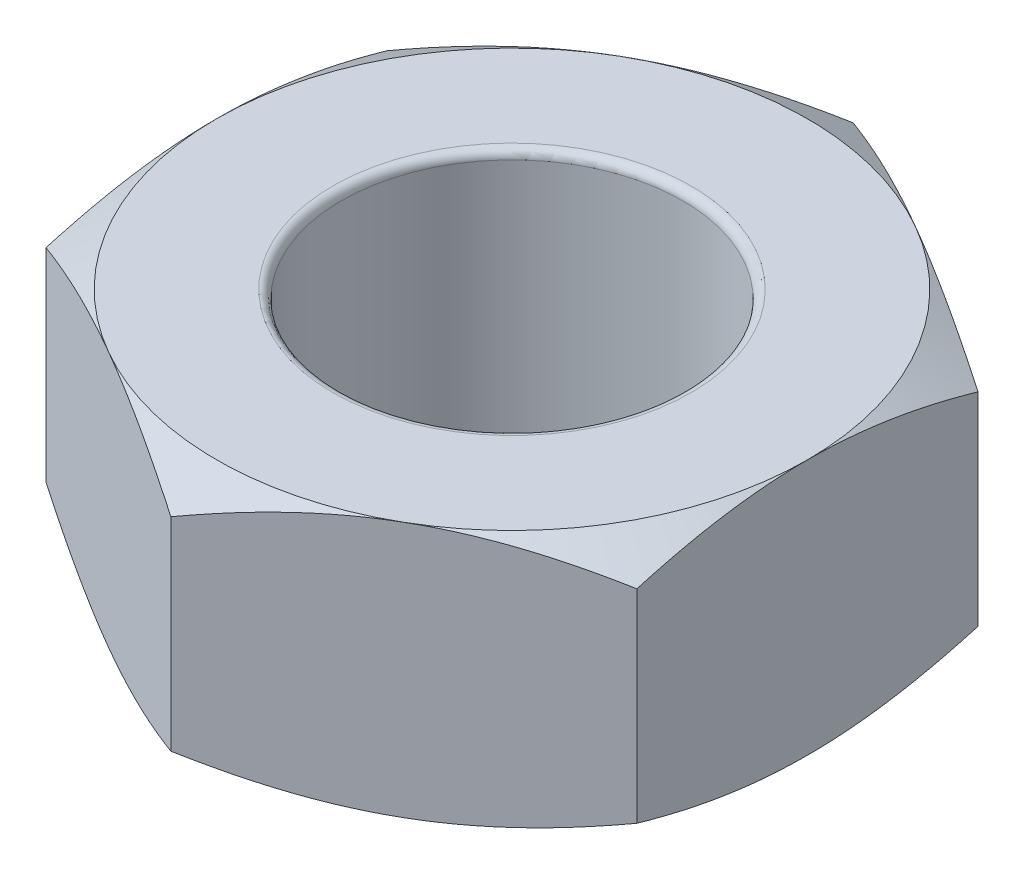
from build123d import *

# Parameters (mm, degrees)
SKETCH1_R           = 1
BOSS_EXTRUDE1_DEPTH = 1.5
SKETCH2_OUTSIDE_W   = 13.492
SKETCH2_OUTSIDE_H   = 14.028
SKETCH2_OUTSIDE_R   = 1.732050808
CUT_EXTRUDE1_DEPTH  = 2
CUT_EXTRUDE1_DRAFT  = -60
SKETCH3_OUTSIDE_W   = 13.492
SKETCH3_OUTSIDE_H   = 14.028
SKETCH3_OUTSIDE_R   = 1.732050808
CUT_EXTRUDE2_DEPTH  = 2
CUT_EXTRUDE2_DRAFT  = -60
FILLET1_R           = 0.05


with BuildPart() as part:
    # Sketch1 → Boss-Extrude1 (new body)
    with BuildSketch(Plane(origin=(0, 0, 0), x_dir=(1, 0, 0), z_dir=(0, 1, 0))):
        Polygon((0, 2), (-1.732050808, 1), (-1.732050808, -1), (0, -2), (1.732050808, -1), (1.732050808, 1), align=None)
        with Locations(Location((0, 0, 0), (0, 0, 270))):
            Circle(SKETCH1_R, mode=Mode.SUBTRACT)
    extrude(amount=BOSS_EXTRUDE1_DEPTH)


with BuildPart() as cut_extrude1_tool:
    # Sketch2 outside → Cut-Extrude1 (with draft: the straight prism first)
    with BuildSketch(Plane(origin=(0, 1.5, 0), x_dir=(1, 0, 0), z_dir=(0, 1, 0))):
        Rectangle(SKETCH2_OUTSIDE_W, SKETCH2_OUTSIDE_H)
        Circle(SKETCH2_OUTSIDE_R, mode=Mode.SUBTRACT)
    extrude(amount=-CUT_EXTRUDE1_DEPTH)
    # Cut-Extrude1: the draft: its side faces are tilted about the plane it starts from
    cut_extrude1_sides = [cut_extrude1_tool.faces().sort_by_distance(p)[0] for p in [
        (0, 0.5, 7.014),
        (6.746, 0.5, 0),
        (0, 0.5, -7.014),
        (-6.746, 0.5, 0),
        (-1.732050808, 0.5, 0),
    ]]
    draft(cut_extrude1_sides, Plane(origin=(0, 1.5, 0), x_dir=(1, 0, 0), z_dir=(0, 1, 0)), CUT_EXTRUDE1_DRAFT)


with BuildPart() as part_1:
    add(part.part)

    # Cut-Extrude1: cut by cut_extrude1_tool
    add(cut_extrude1_tool.part, mode=Mode.SUBTRACT)


with BuildPart() as cut_extrude2_tool:
    # Sketch3 outside → Cut-Extrude2 (with draft: the straight prism first)
    with BuildSketch(Plane.XZ):
        Rectangle(SKETCH3_OUTSIDE_W, SKETCH3_OUTSIDE_H)
        Circle(SKETCH3_OUTSIDE_R, mode=Mode.SUBTRACT)
    extrude(amount=-CUT_EXTRUDE2_DEPTH)
    # Cut-Extrude2: the draft: its side faces are tilted about the plane it starts from
    cut_extrude2_sides = [cut_extrude2_tool.faces().sort_by_distance(p)[0] for p in [
        (0, 1, -7.014),
        (6.746, 1, 0),
        (0, 1, 7.014),
        (-6.746, 1, 0),
        (-1.732050808, 1, 0),
    ]]
    draft(cut_extrude2_sides, Plane.XZ, CUT_EXTRUDE2_DRAFT)


with BuildPart() as part_2:
    add(part_1.part)

    # Cut-Extrude2: cut by cut_extrude2_tool
    add(cut_extrude2_tool.part, mode=Mode.SUBTRACT)

    # Fillet1
    fillet1_edges = [part_2.edges().sort_by_distance(p)[0] for p in [
        (0, 0, -1),
        (0, 1.5, -1),
    ]]
    fillet(fillet1_edges, radius=FILLET1_R)


solid = part_2.part
